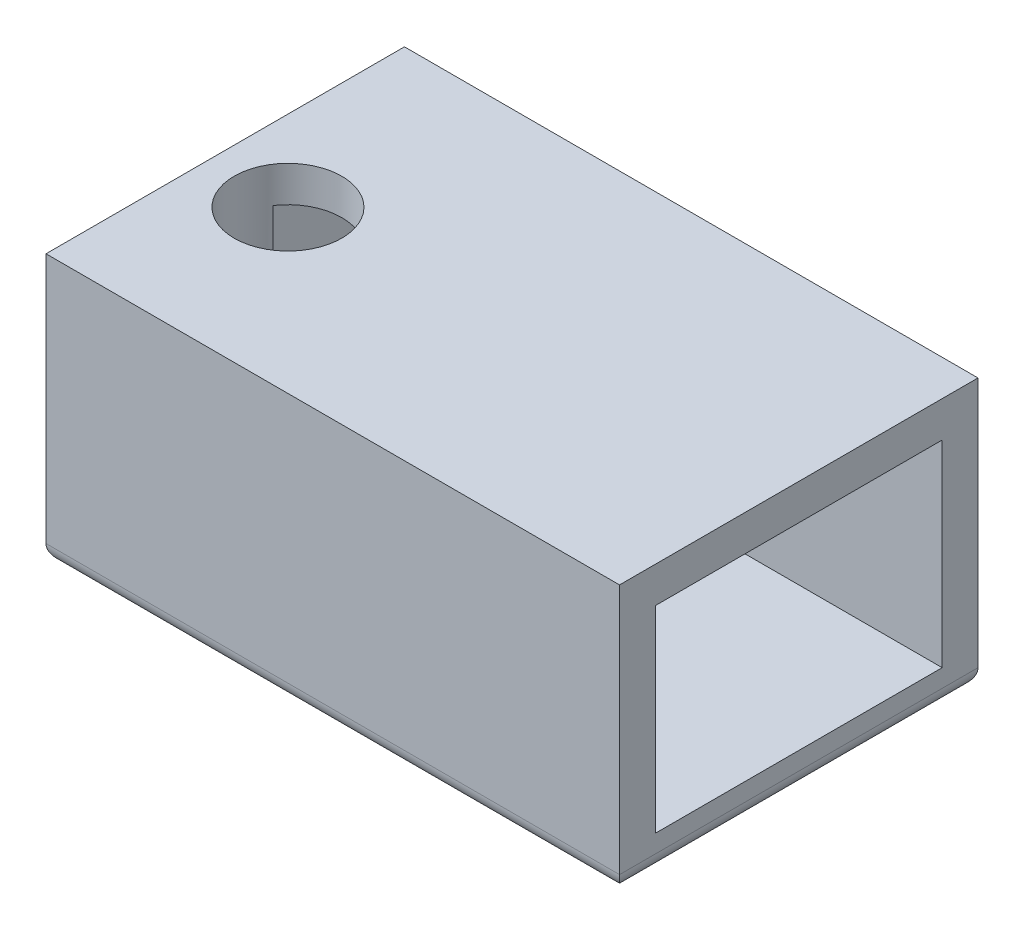
from build123d import *

# Parameters (mm, degrees)
SKETCH1_W           = 30
SKETCH1_H           = 16
BOSS_EXTRUDE1_DEPTH = 11
SHELL1_T            = 2
CUT_EXTRUDE3_REACH  = 26.779
SKETCH4_R           = 3
FILLET1_R           = 1


with BuildPart() as part:
    # Sketch1 → Boss-Extrude1 (new body)
    with BuildSketch(Plane(origin=(0, 0, 0), x_dir=(1, 0, 0), z_dir=(0, 1, 0))):
        Rectangle(SKETCH1_W, SKETCH1_H)
    extrude(amount=BOSS_EXTRUDE1_DEPTH)

    # Shell1
    shell1_openings = [part.faces().sort_by_distance(p)[0] for p in [
        (15, 5.5, 0),
    ]]
    offset(amount=SHELL1_T, openings=shell1_openings, kind=Kind.INTERSECTION)

    # Cut-Extrude3: up to this face of the body (flat: up to its plane)
    cut_extrude3_end = Plane(part.part.faces().sort_by_distance((0, 0, 0))[0])
    # Sketch4 → Cut-Extrude3 (cut, up to the picked face)
    with BuildSketch(Plane(origin=(0, 13, 0), x_dir=(1, 0, 0), z_dir=(0, 1, 0)), mode=Mode.PRIVATE) as cut_extrude3_sk1:
        with Locations(Location((-12.5, -1, 0), (0, 0, 270))):
            Circle(SKETCH4_R)
    cut_extrude3_tool1 = split(extrude(cut_extrude3_sk1.sketch, amount=-CUT_EXTRUDE3_REACH, mode=Mode.PRIVATE), bisect_by=cut_extrude3_end, keep=Keep.BOTH, mode=Mode.PRIVATE)
    add(cut_extrude3_tool1.solids().sort_by(Axis((-12.5, 13, 1), (0, -1, 0)))[0], mode=Mode.SUBTRACT)

    # Fillet1
    fillet1_edges = [part.edges().sort_by_distance(p)[0] for p in [
        (-1, -2, 10),
        (-17, -2, 0),
        (-1, -2, -10),
        (15, -2, 0),
    ]]
    fillet(fillet1_edges, radius=FILLET1_R)


solid = part.part
